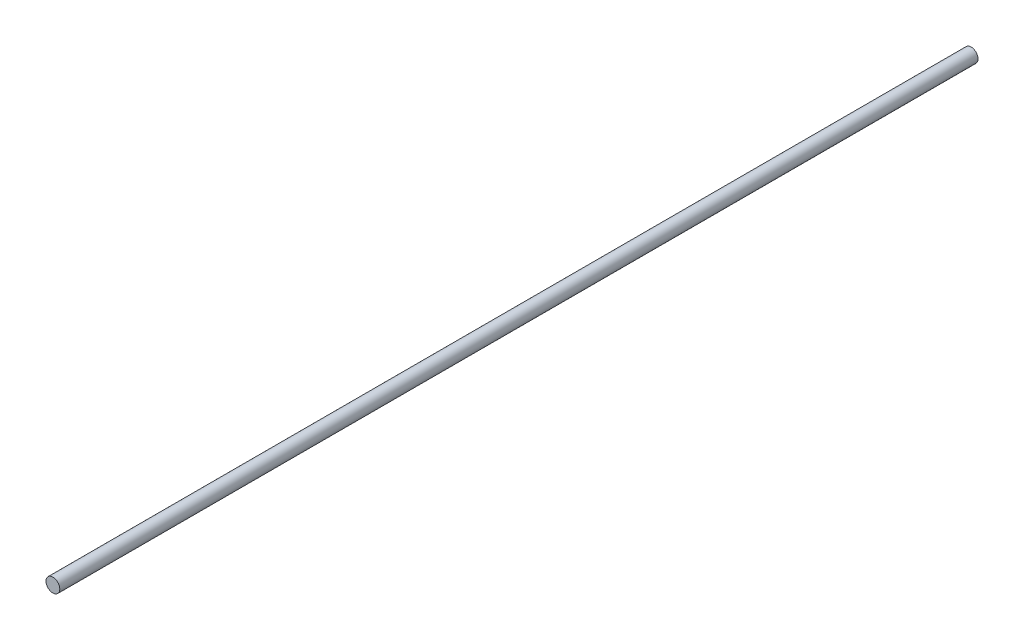
from build123d import *

# Parameters (mm, degrees)
SKETCH1_R           = 4.7625
BOSS_EXTRUDE1_DEPTH = 635


with BuildPart() as part:
    # Sketch1 → Boss-Extrude1 (new body)
    with BuildSketch(Plane.XY):
        with Locations(Location((0, 0, 0), (0, 0, 180))):
            Circle(SKETCH1_R)
    extrude(amount=BOSS_EXTRUDE1_DEPTH)


solid = part.part
